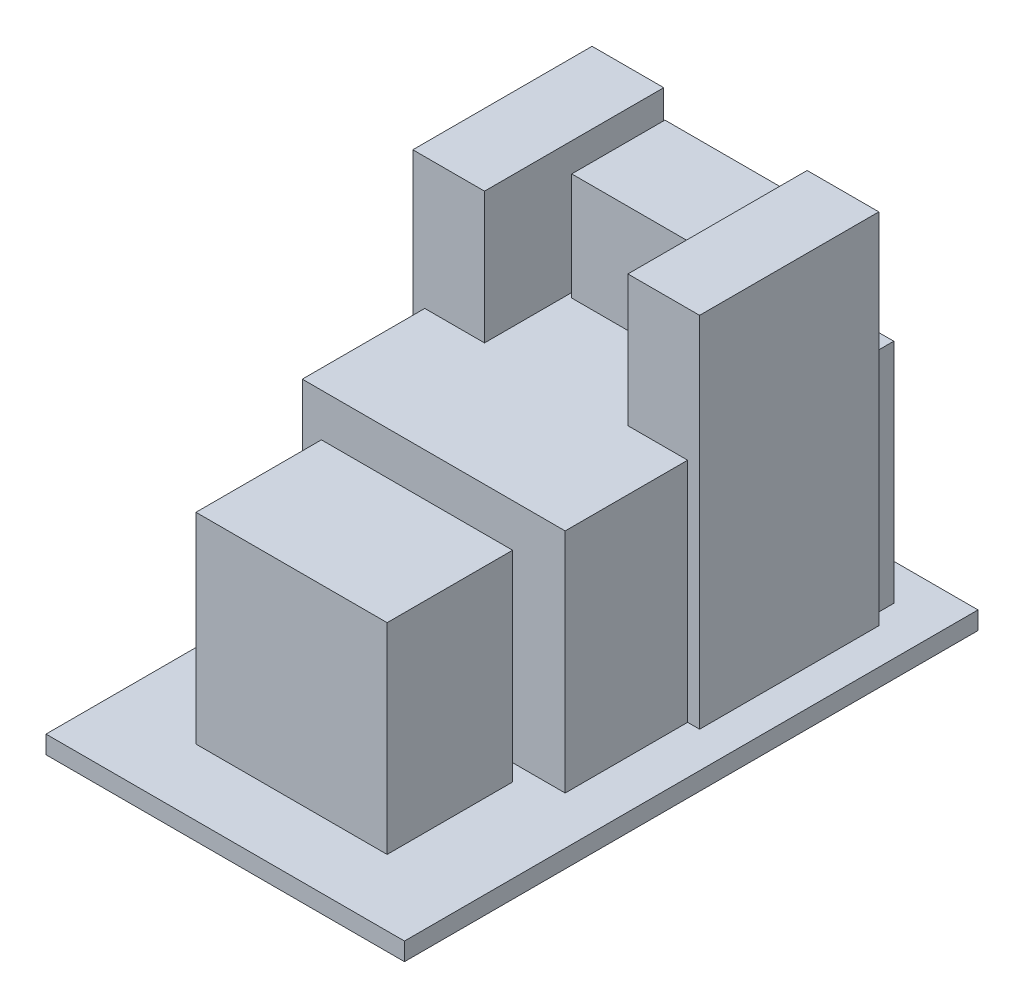
from build123d import *

# Parameters (mm, degrees)
SKETCH_1_W      = 300
SKETCH_1_H      = 480
EXTRUDE_1_DEPTH = 15
SKETCH_2_W      = 220
SKETCH_2_H      = 275
EXTRUDE_2_DEPTH = 190
SKETCH_3_W      = 160
SKETCH_3_H      = 105
EXTRUDE_3_DEPTH = 168
SKETCH_4_W      = 60
SKETCH_4_H      = 150
EXTRUDE_4_DEPTH = 300
SKETCH_5_W      = 60
SKETCH_5_H      = 150
EXTRUDE_5_DEPTH = 300
SKETCH_6_W      = 112
SKETCH_6_H      = 78
EXTRUDE_6_DEPTH = 280


with BuildPart() as part:
    # 草图1 → 凸台-拉伸1 (new body)
    with BuildSketch(Plane(origin=(0, 0, 0), x_dir=(1, 0, 0), z_dir=(0, 1, 0))):
        Rectangle(SKETCH_1_W, SKETCH_1_H)
    extrude(amount=-EXTRUDE_1_DEPTH)

    # 草图2 → 凸台-拉伸2 (add)
    with BuildSketch(Plane(origin=(0, 0, 0), x_dir=(1, 0, 0), z_dir=(0, 1, 0))):
        with Locations((0, 72)):
            Rectangle(SKETCH_2_W, SKETCH_2_H)
    extrude(amount=EXTRUDE_2_DEPTH)

    # 草图3 → 凸台-拉伸3 (add)
    with BuildSketch(Plane(origin=(0, 0, 0), x_dir=(1, 0, 0), z_dir=(0, 1, 0))):
        with Locations((0, -132)):
            Rectangle(SKETCH_3_W, SKETCH_3_H)
    extrude(amount=EXTRUDE_3_DEPTH)

    # 草图4 → 凸台-拉伸4 (add)
    with BuildSketch(Plane(origin=(0, 0, 0), x_dir=(1, 0, 0), z_dir=(0, 1, 0))):
        with Locations((-90, 112)):
            Rectangle(SKETCH_4_W, SKETCH_4_H)
    extrude(amount=EXTRUDE_4_DEPTH)

    # 草图5 → 凸台-拉伸5 (add)
    with BuildSketch(Plane(origin=(0, 0, 0), x_dir=(1, 0, 0), z_dir=(0, 1, 0))):
        with Locations((90, 112)):
            Rectangle(SKETCH_5_W, SKETCH_5_H)
    extrude(amount=EXTRUDE_5_DEPTH)

    # 草图6 → 凸台-拉伸6 (add)
    with BuildSketch(Plane(origin=(0, 0, 0), x_dir=(1, 0, 0), z_dir=(0, 1, 0))):
        with Locations((0, 145)):
            Rectangle(SKETCH_6_W, SKETCH_6_H)
    extrude(amount=EXTRUDE_6_DEPTH)


solid = part.part
